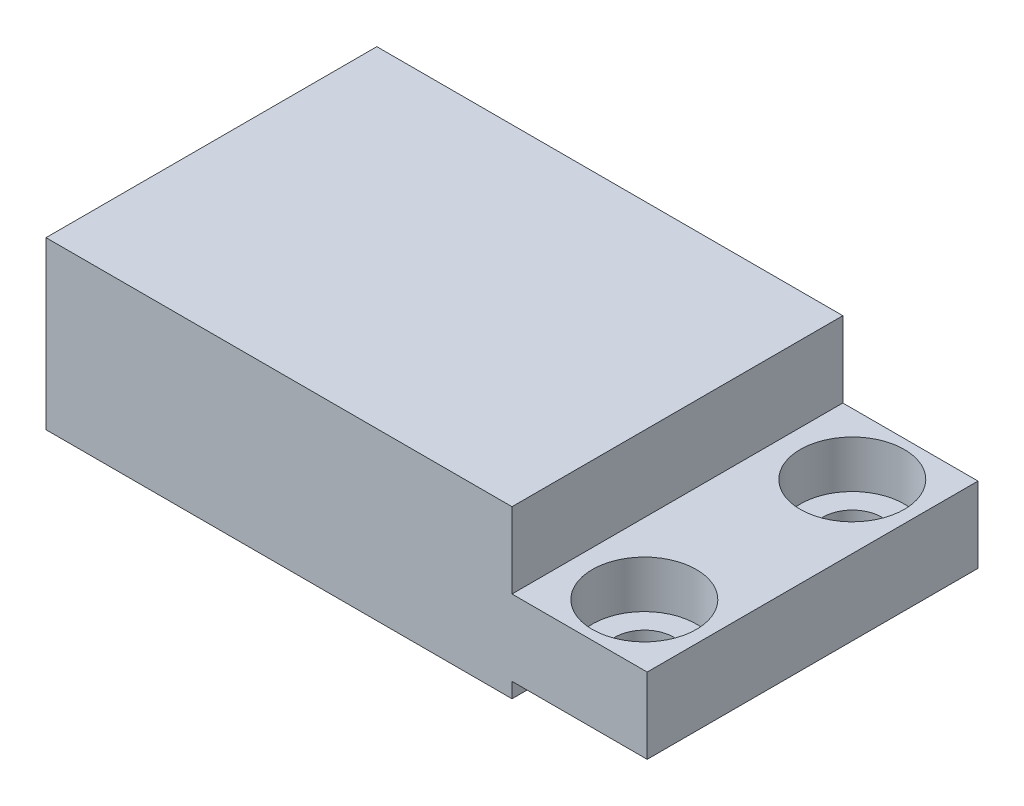
from build123d import *

# Parameters (mm, degrees)
SZKIC1_W                                          = 31.8
SZKIC1_H                                          = 8.8
DODANIE_WYCI_GNI_CIE1_DEPTH                       = 8.75
SZKIC2_W                                          = 7.15
SZKIC2_H                                          = 17.5
WYTNIJ_WYCI_GNI_CIE1_DEPTH                        = 0.8
SZKIC3_W                                          = 7.15
SZKIC3_H                                          = 4
WYTNIJ_WYCI_GNI_CIE2_DEPTH                        = 26.228951623
POG_BIENIE_WALCOWE_POD_M2_5_RUB_Z_BEM_D           = 3.1
POG_BIENIE_WALCOWE_POD_M2_5_RUB_Z_BEM_CBORE_D     = 5.5
POG_BIENIE_WALCOWE_POD_M2_5_RUB_Z_BEM_CBORE_DEPTH = 2.5


with BuildPart() as part:
    # Szkic1 → Dodanie-wyciągnięcie1 (new, symmetric)
    with BuildSketch(Plane.XY):
        with Locations((0, 4.4)):
            Rectangle(SZKIC1_W, SZKIC1_H)
    extrude(amount=DODANIE_WYCI_GNI_CIE1_DEPTH, both=True)

    # Szkic2 → Wytnij-wyciągnięcie1 (cut)
    with BuildSketch(Plane.XZ):
        with Locations((12.325, 0)):
            Rectangle(SZKIC2_W, SZKIC2_H)
    extrude(amount=-WYTNIJ_WYCI_GNI_CIE1_DEPTH, mode=Mode.SUBTRACT)

    # Szkic3 → Wytnij-wyciągnięcie2 (cut, through all)
    with BuildSketch(Plane.XY.offset(8.75)):
        with Locations((12.325, 6.8)):
            Rectangle(SZKIC3_W, SZKIC3_H)
    extrude(amount=-WYTNIJ_WYCI_GNI_CIE2_DEPTH, mode=Mode.SUBTRACT)

    # Pogłębienie walcowe pod M2.5 Śrubę z łbem walcowym z gniazdem1 (through all)
    with Locations(Plane(origin=(0, 4.8, 0), x_dir=(1, 0, 0), z_dir=(0, 1, 0))):
        with Locations((12.5, 5.5), (12.5, -5.5)):
            CounterBoreHole(POG_BIENIE_WALCOWE_POD_M2_5_RUB_Z_BEM_D / 2, POG_BIENIE_WALCOWE_POD_M2_5_RUB_Z_BEM_CBORE_D / 2, POG_BIENIE_WALCOWE_POD_M2_5_RUB_Z_BEM_CBORE_DEPTH)


solid = part.part
